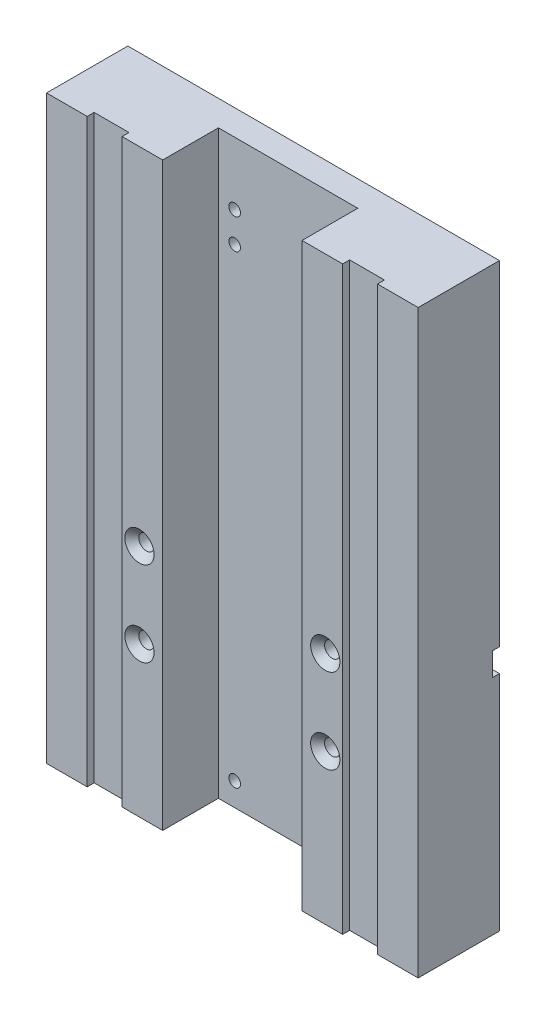
from build123d import *

# Parameters (mm, degrees)
SKETCH_9_W                 = 160
SKETCH_9_H                 = 250
EXTRUDE_499_DEPTH          = 35
SKETCH_14_W                = 160
SKETCH_14_H                = 10
CUT_EXTRUDE_746_DEPTH      = 3
HOLE_WIZARD_M6_D           = 6.6
HOLE_WIZARD_M6_CSINK_D     = 12.6
HOLE_WIZARD_M6_CSINK_ANGLE = 90
SKETCH_11_W                = 60
SKETCH_11_H                = 250
CUT_EXTRUDE_2132_DEPTH     = 24
SKETCH_15_W                = 15
SKETCH_15_H                = 300
CUT_EXTRUDE_2595_DEPTH     = 3
HOLE_WIZARD_M6_2_D         = 5
HOLE_WIZARD_3653_D         = 5


with BuildPart() as part:
    # Эскиз9 → Extrude 499 (new body)
    with BuildSketch(Plane(origin=(-20, 0, 0), x_dir=(-1, 0, 0), z_dir=(0, 0, -1))):
        with Locations((-20, 77)):
            Rectangle(SKETCH_9_W, SKETCH_9_H)
    extrude(amount=EXTRUDE_499_DEPTH)

    # Эскиз14 → Cut-Extrude 746 (cut)
    with BuildSketch(Plane(origin=(0, 0, -35), x_dir=(-1, 0, 0), z_dir=(0, 0, -1))):
        with Locations((0, 53)):
            Rectangle(SKETCH_14_W, SKETCH_14_H)
    extrude(amount=-CUT_EXTRUDE_746_DEPTH, mode=Mode.SUBTRACT)

    # Hole Wizard M6 (through all)
    with Locations(Plane.XY):
        with Locations((-40, 53), (40, 53), (-40, 16.5), (40, 16.5)):
            CounterSinkHole(HOLE_WIZARD_M6_D / 2, HOLE_WIZARD_M6_CSINK_D / 2, counter_sink_angle=HOLE_WIZARD_M6_CSINK_ANGLE)

    # Эскиз11 → Cut-Extrude 2132 (cut)
    with BuildSketch(Plane(origin=(0, 0, 0), x_dir=(-1, 0, 0), z_dir=(0, 0, -1))):
        with Locations((0, 77)):
            Rectangle(SKETCH_11_W, SKETCH_11_H)
    extrude(amount=CUT_EXTRUDE_2132_DEPTH, mode=Mode.SUBTRACT)

    # Эскиз15 → Cut-Extrude 2595 (cut)
    with BuildSketch(Plane.XY):
        with Locations((-55, 102)):
            Rectangle(SKETCH_15_W, SKETCH_15_H)
        with Locations((55, 102)):
            Rectangle(SKETCH_15_W, SKETCH_15_H)
    extrude(amount=-CUT_EXTRUDE_2595_DEPTH, mode=Mode.SUBTRACT)

    # Hole Wizard M6 2 (through all)
    with Locations(Plane.XY.offset(-24)):
        with Locations((-23, -38), (23, -38)):
            Hole(HOLE_WIZARD_M6_2_D / 2)

    # Hole Wizard 3653 (through all)
    with Locations(Plane.XY.offset(-24)):
        with Locations((-23, 162), (23, 162), (-23, 175), (23, 175)):
            Hole(HOLE_WIZARD_3653_D / 2)


solid = part.part
